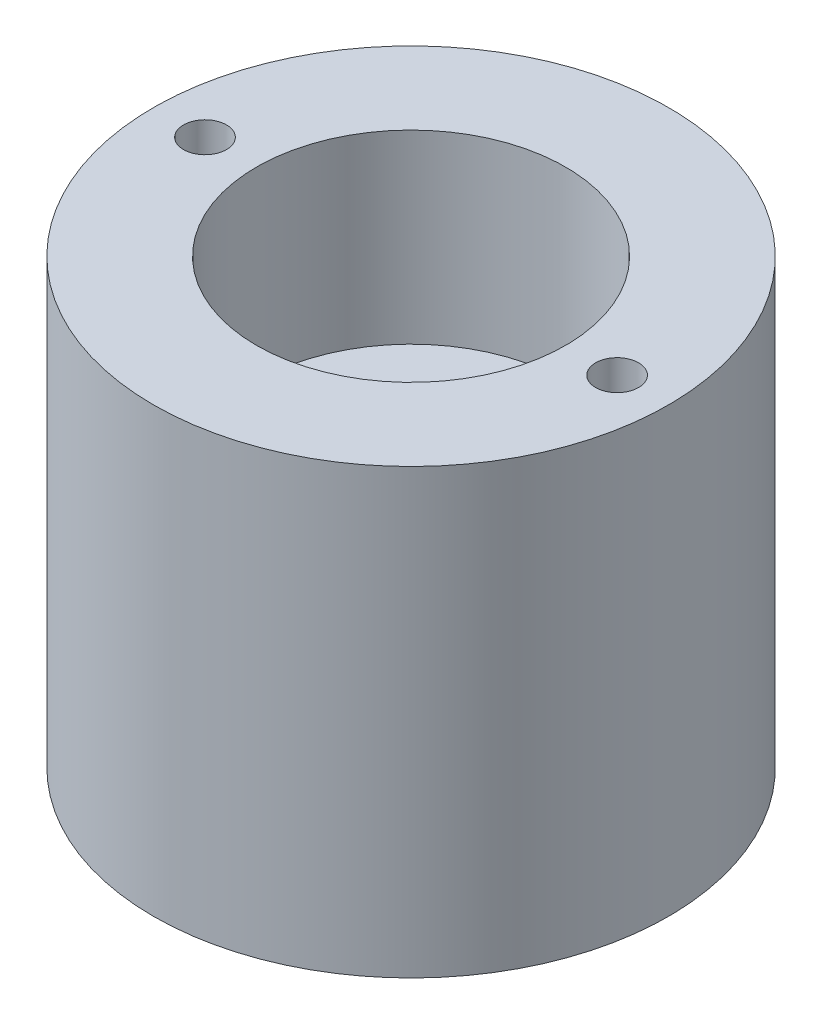
from build123d import *

# Parameters (mm, degrees)
SKETCH_1_R           = 4
EXTRUDE_1_DEPTH      = 11
SKETCH_2_R           = 3.01
CUT_EXTRUDE_2_DEPTH  = 2
SKETCH_3_R           = 2.5
CUT_EXTRUDE_3_DEPTH  = 4.3
SKETCH_4_W           = 2.01
SKETCH_4_H           = 4.01
CUT_EXTRUDE_4_DEPTH  = 0.7
SKETCH_5_R           = 2.5
CUT_EXTRUDE_5_DEPTH  = 1
SKETCH_7_R           = 4
CUT_EXTRUDE_6_DEPTH  = 10
SKETCH_12_R          = 3.25
CUT_EXTRUDE_7_DEPTH  = 2
SKETCH_13_R          = 4
SKETCH_13_R_2        = 2.5
EXTRUDE_2_DEPTH      = 2
CUT_EXTRUDE_START    = -3
SKETCH_14_R          = 4
SKETCH_14_R_2        = 2.5
CUT_EXTRUDE_8_DEPTH  = 3
SKETCH_15_R          = 7
SKETCH_15_R_2        = 5
EXTRUDE_3_DEPTH      = 14.9
EXTRUDE_START        = 7
SKETCH_16_R          = 7
SKETCH_16_R_2        = 4
EXTRUDE_4_DEPTH      = 7
SKETCH_17_R          = 0.8
CUT_EXTRUDE_10_DEPTH = 5
SKETCH_18_R          = 5
SKETCH_18_W          = 2.01
SKETCH_18_H          = 2.999191688
EXTRUDE_5_DEPTH      = 0.5
SKETCH_20_R          = 0.625
CUT_EXTRUDE_11_DEPTH = 9
CUT_EXTRUDE_START_2  = -9
SKETCH_21_R          = 7
CUT_EXTRUDE_12_DEPTH = 9
EXTRUDE_START_2      = -12.9
SKETCH_22_R          = 7.5
SKETCH_22_R_2        = 7
EXTRUDE_7_DEPTH      = 12.9
EXTRUDE_START_3      = -10
SKETCH_23_R          = 5
SKETCH_23_R_2        = 4.5
EXTRUDE_8_DEPTH      = 10


with BuildPart() as part:
    # Эскиз1 → Бобышка-Вытянуть1 (new body)
    with BuildSketch(Plane(origin=(0, 0, 0), x_dir=(1, 0, 0), z_dir=(0, 1, 0))):
        with Locations(Location((0, 0, 0), (0, 0, 270))):
            Circle(SKETCH_1_R)
    extrude(amount=EXTRUDE_1_DEPTH)

    # Эскиз2 → Вырез-Вытянуть2 (cut)
    with BuildSketch(Plane.XZ):
        with Locations(Location((0, 0, 0), (0, 0, 270))):
            Circle(SKETCH_2_R)
    extrude(amount=-CUT_EXTRUDE_2_DEPTH, mode=Mode.SUBTRACT)

    # Эскиз3 → Вырез-Вытянуть3 (cut)
    with BuildSketch(Plane.XZ.offset(-2)):
        with Locations(Location((0, 0, 0), (0, 0, 270))):
            Circle(SKETCH_3_R)
    extrude(amount=-CUT_EXTRUDE_3_DEPTH, mode=Mode.SUBTRACT)

    # Эскиз4 → Вырез-Вытянуть4 (cut)
    with BuildSketch(Plane.XZ.offset(-6.3)):
        Rectangle(SKETCH_4_W, SKETCH_4_H)
    extrude(amount=-CUT_EXTRUDE_4_DEPTH, mode=Mode.SUBTRACT)

    # Эскиз5 → Вырез-Вытянуть5 (cut)
    with BuildSketch(Plane.XZ.offset(-7)):
        with Locations(Location((0, 0, 0), (0, 0, 270))):
            Circle(SKETCH_5_R)
    extrude(amount=-CUT_EXTRUDE_5_DEPTH, mode=Mode.SUBTRACT)

    # Эскиз7 → Вырез-Вытянуть6 (cut)
    with BuildSketch(Plane.XZ.offset(-8)):
        with Locations(Location((0, 0, 0), (0, 0, 270))):
            Circle(SKETCH_7_R)
    extrude(amount=-CUT_EXTRUDE_6_DEPTH, mode=Mode.SUBTRACT)

    # Эскиз12 → Вырез-Вытянуть7 (cut)
    with BuildSketch(Plane.XZ):
        with Locations(Location((0, 0, 0), (0, 0, 270))):
            Circle(SKETCH_12_R)
    extrude(amount=-CUT_EXTRUDE_7_DEPTH, mode=Mode.SUBTRACT)

    # Эскиз13 → Бобышка-Вытянуть2 (add)
    with BuildSketch(Plane(origin=(0, 8, 0), x_dir=(1, 0, 0), z_dir=(0, 1, 0))):
        with Locations(Location((0, 0, 0), (0, 0, 270))):
            Circle(SKETCH_13_R)
        with Locations(Location((0, 0, 0), (0, 0, 90))):
            Circle(SKETCH_13_R_2, mode=Mode.SUBTRACT)
    extrude(amount=EXTRUDE_2_DEPTH)

    # Эскиз14 → Вырез-Вытянуть8 (cut)
    with BuildSketch(Plane(origin=(0, 10, 0), x_dir=(1, 0, 0), z_dir=(0, 1, 0)).offset(CUT_EXTRUDE_START)):
        with Locations(Location((0, 0, 0), (0, 0, 270))):
            Circle(SKETCH_14_R)
        with Locations(Location((0, 0, 0), (0, 0, 90))):
            Circle(SKETCH_14_R_2, mode=Mode.SUBTRACT)
    extrude(amount=CUT_EXTRUDE_8_DEPTH, mode=Mode.SUBTRACT)



with BuildPart() as body_2:
    # Эскиз15 → Бобышка-Вытянуть3 (new body)
    with BuildSketch(Plane(origin=(0, 7, 0), x_dir=(1, 0, 0), z_dir=(0, 1, 0))):
        with Locations(Location((0, 0, 0), (0, 0, 270))):
            Circle(SKETCH_15_R)
        with Locations(Location((0, 0, 0), (0, 0, 270))):
            Circle(SKETCH_15_R_2, mode=Mode.SUBTRACT)
    extrude(amount=EXTRUDE_3_DEPTH)


with BuildPart() as part_1:
    add(part.part)

    add(body_2.part)  # Бобышка-Вытянуть4 merges body 2
    # Эскиз16 → Бобышка-Вытянуть4 (add)
    with BuildSketch(Plane.XZ.offset(-7).offset(EXTRUDE_START)):
        with Locations(Location((0, 0, 0), (0, 0, 90))):
            Circle(SKETCH_16_R)
        Circle(SKETCH_16_R_2, mode=Mode.SUBTRACT)
    extrude(amount=-EXTRUDE_4_DEPTH)

    # Эскиз17 → Вырез-Вытянуть10 (cut)
    with BuildSketch(Plane(origin=(0, 21.9, 0), x_dir=(1, 0, 0), z_dir=(0, 1, 0))):
        with Locations(Location((6, 0, 0), (0, 0, 270))):
            Circle(SKETCH_17_R)
        with Locations(Location((-6, 0, 0), (0, 0, 90))):
            Circle(SKETCH_17_R)
    extrude(amount=-CUT_EXTRUDE_10_DEPTH, mode=Mode.SUBTRACT)

    # Эскиз18 → Бобышка-Вытянуть5 (add)
    with BuildSketch(Plane(origin=(0, 7, 0), x_dir=(1, 0, 0), z_dir=(0, 1, 0))):
        with Locations(Location((0, 0, 0), (0, 0, 180))):
            Circle(SKETCH_18_R)
        with Locations((0, 0.005404156)):
            Rectangle(SKETCH_18_W, SKETCH_18_H, mode=Mode.SUBTRACT)
    extrude(amount=EXTRUDE_5_DEPTH)

    # Эскиз20 → Вырез-Вытянуть11 (cut)
    with BuildSketch(Plane(origin=(0, 16.9, 0), x_dir=(1, 0, 0), z_dir=(0, 1, 0))):
        with Locations(Location((6, 0, 0), (0, 0, 270))):
            Circle(SKETCH_20_R)
        with Locations(Location((-6, 0, 0), (0, 0, 270))):
            Circle(SKETCH_20_R)
    extrude(amount=-CUT_EXTRUDE_11_DEPTH, mode=Mode.SUBTRACT)

    # Эскиз21 → Вырез-Вытянуть12 (cut)
    with BuildSketch(Plane(origin=(0, 21.9, 0), x_dir=(1, 0, 0), z_dir=(0, 1, 0)).offset(CUT_EXTRUDE_START_2)):
        with Locations(Location((0, 0, 0), (0, 0, 270))):
            Circle(SKETCH_21_R)
    extrude(amount=CUT_EXTRUDE_12_DEPTH, mode=Mode.SUBTRACT)

    # Эскиз22 → Бобышка-Вытянуть7 (add)
    with BuildSketch(Plane(origin=(0, 12.9, 0), x_dir=(1, 0, 0), z_dir=(0, 1, 0)).offset(EXTRUDE_START_2)):
        with Locations(Location((0, 0, 0), (0, 0, 270))):
            Circle(SKETCH_22_R)
        Circle(SKETCH_22_R_2, mode=Mode.SUBTRACT)
    extrude(amount=EXTRUDE_7_DEPTH)

    # Эскиз23 → Бобышка-Вытянуть8 (add)
    with BuildSketch(Plane(origin=(0, 12.9, 0), x_dir=(1, 0, 0), z_dir=(0, 1, 0)).offset(EXTRUDE_START_3)):
        Circle(SKETCH_23_R)
        with Locations(Location((0, 0, 0), (0, 0, 270))):
            Circle(SKETCH_23_R_2, mode=Mode.SUBTRACT)
    extrude(amount=EXTRUDE_8_DEPTH)


solid = part_1.part
